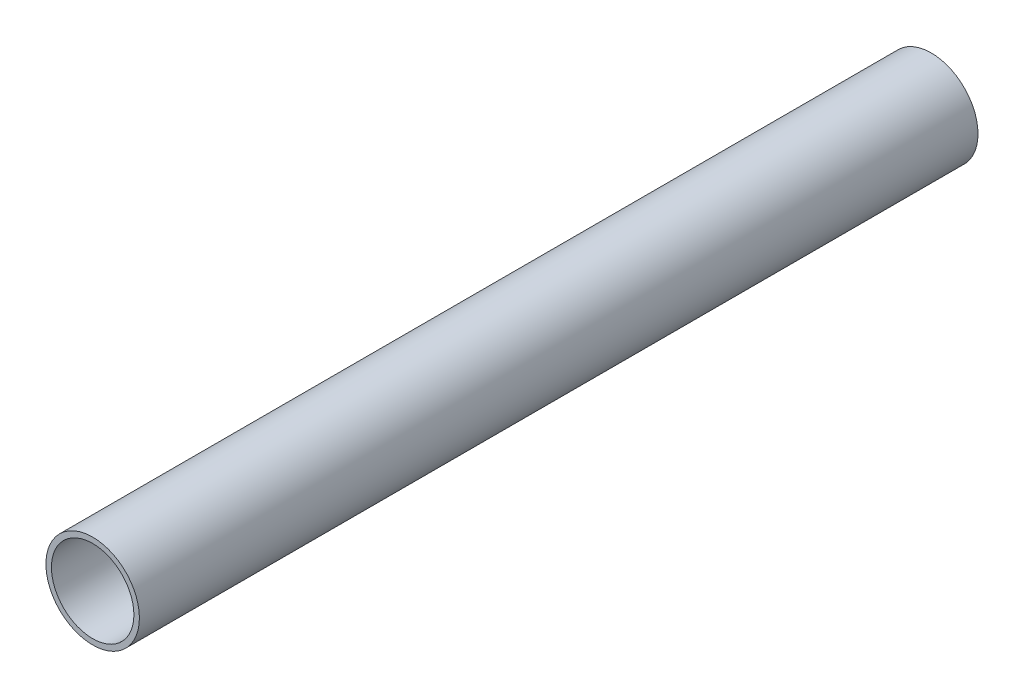
from build123d import *

# Parameters (mm, degrees)
SKETCH_1_R      = 17
SKETCH_1_R_2    = 15
EXTRUDE_1_DEPTH = 305


with BuildPart() as part:
    # 草图1 → 凸台-拉伸1 (new body)
    with BuildSketch(Plane.XY):
        Circle(SKETCH_1_R)
        Circle(SKETCH_1_R_2, mode=Mode.SUBTRACT)
    extrude(amount=EXTRUDE_1_DEPTH)


solid = part.part
